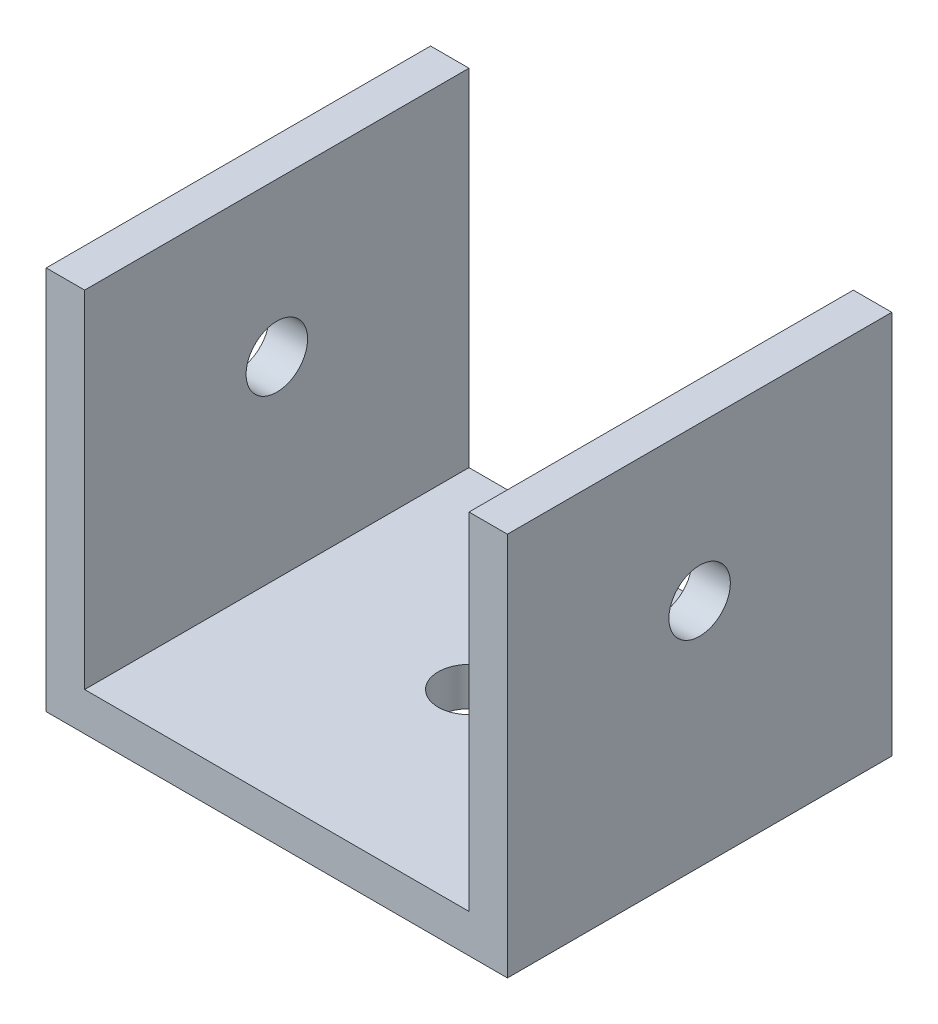
from build123d import *

# Parameters (mm, degrees)
SKETCH_1_W          = 50
SKETCH_1_H          = 50
EXTRUDE_1_DEPTH     = 5
SKETCH_2_W          = 50
SKETCH_2_H          = 50
EXTRUDE_2_DEPTH     = 5
SKETCH_3_R          = 4
CUT_EXTRUDE_1_DEPTH = 10
SKETCH_4_R          = 4
CUT_EXTRUDE_2_DEPTH = 83.006097334


with BuildPart() as part:
    # 草图1 → 凸台-拉伸1 (new body)
    with BuildSketch(Plane(origin=(0, 0, 0), x_dir=(1, 0, 0), z_dir=(0, 1, 0))):
        Rectangle(SKETCH_1_W, SKETCH_1_H)
    extrude(amount=EXTRUDE_1_DEPTH)

    # 草图2 → 凸台-拉伸2 (add)
    with BuildSketch(Plane(origin=(25, 0, 0), x_dir=(0, 0, -1), z_dir=(1, 0, 0))):
        with Locations((0, 25)):
            Rectangle(SKETCH_2_W, SKETCH_2_H)
    extrude_2 = extrude(amount=EXTRUDE_2_DEPTH)

    # 镜向1: 凸台-拉伸2 across plane
    add(extrude_2.mirror(Plane(origin=(0, 0, 0), x_dir=(0, 0, 1), z_dir=(1, 0, 0))))

    # 草图3 → 切除-拉伸1 (cut)
    with BuildSketch(Plane(origin=(0, 5, 0), x_dir=(1, 0, 0), z_dir=(0, 1, 0))):
        with Locations(Location((0, 0, 0), (0, 0, 270))):
            Circle(SKETCH_3_R)
    extrude(amount=-CUT_EXTRUDE_1_DEPTH, mode=Mode.SUBTRACT)

    # 草图4 → 切除-拉伸2 (cut, through all)
    with BuildSketch(Plane(origin=(30, 0, 0), x_dir=(0, 0, -1), z_dir=(1, 0, 0))):
        with Locations((0, 30)):
            Circle(SKETCH_4_R)
    extrude(amount=-CUT_EXTRUDE_2_DEPTH, mode=Mode.SUBTRACT)


solid = part.part
